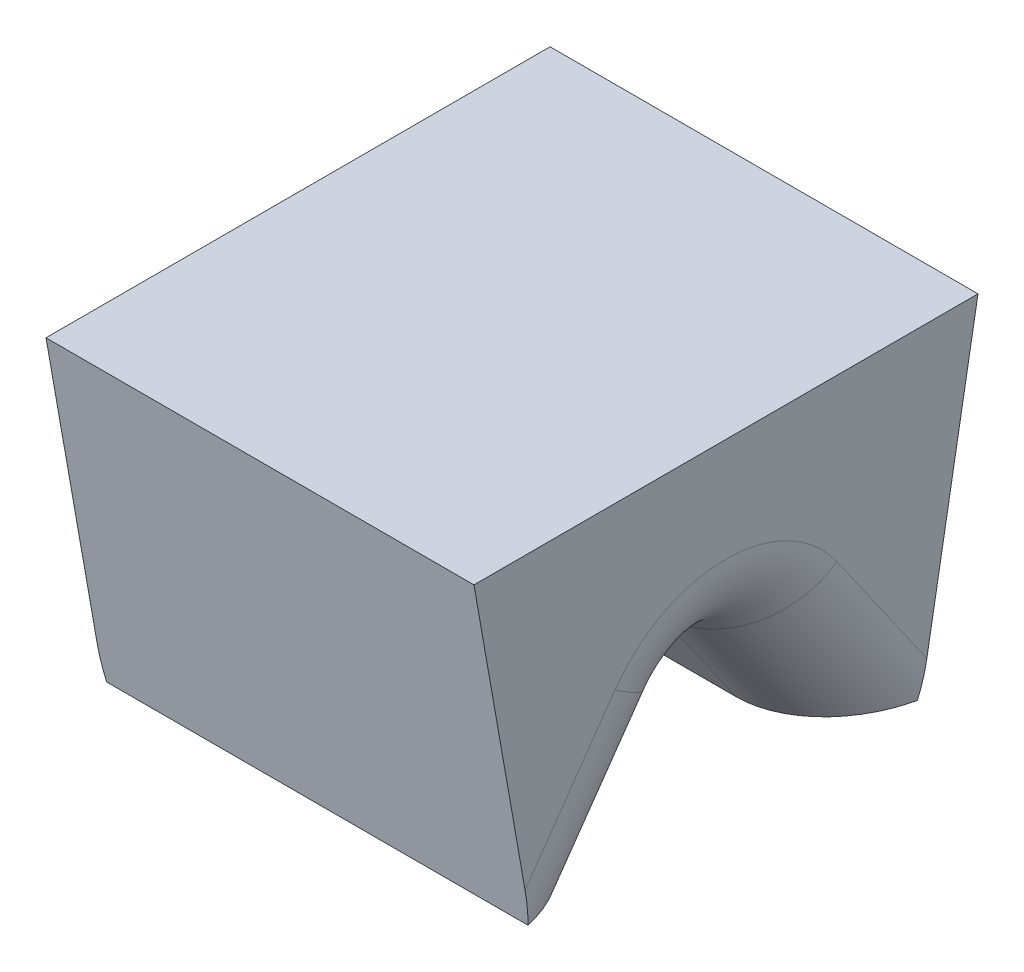
from build123d import *

# Parameters (mm, degrees)
SKETCH_TL_CUTTING_R    = 1.4986
TL_CUTTING_DEPTH       = 75.9968
SKETCH_TDF_CUTTING_W   = 3.01719996
SKETCH_TDF_CUTTING_H   = 3.01719996
TDF_CUTTING_DEPTH      = 77.026345527
VW_VR_GRINDING_DEPTH   = 1.50859998
VW_VR_GRINDING_2_DEPTH = 1.50859998
ISA_GRINDING_DEPTH     = 1.50859998
SKETCH_PRE_FRX_BRX_W   = 0.92980002
SKETCH_PRE_FRX_BRX_H   = 1.4986
SKETCH_PRE_FRX_BRX_W_2 = 0.97757996
PRE_FRX_BRX_DEPTH      = 1.50859998
FA_BA_GRINDING_DEPTH   = 1.50859998
BR_EDM_R               = 0.24892
FR_EDM_R               = 0.24892
SKETCH_ENGRAVING_W     = 0.033186299
SKETCH_ENGRAVING_H     = 1.128593452
SKETCH_ENGRAVING_H_2   = 1.128593453
ENGRAVING_DEPTH        = 0.005


with BuildPart() as part:
    # sketch_TL_cutting → TL_cutting (new body)
    with BuildSketch(Plane(origin=(0, 0, 0), x_dir=(1, 0, 0), z_dir=(0, 1, 0))):
        with Locations(Location((0, 0, 0), (0, 0, 270))):
            Circle(SKETCH_TL_CUTTING_R)
    extrude(amount=TL_CUTTING_DEPTH)

    # sketch_TDF_cutting → TDF_cutting (cut, through all)
    with BuildSketch(Plane(origin=(0, 0, 0), x_dir=(1, 0, 0), z_dir=(0, 1, 0))):
        with Locations((-2.71001998, 0)):
            Rectangle(SKETCH_TDF_CUTTING_W, SKETCH_TDF_CUTTING_H)
    extrude(amount=TDF_CUTTING_DEPTH, mode=Mode.SUBTRACT)


with BuildPart() as body_2:
    # sketch_VW_VR_grinding → VW_VR_grinding (new, symmetric)
    with BuildSketch(Plane(origin=(0, 0, 0), x_dir=(0, 0, -1), z_dir=(1, 0, 0))):
        with BuildLine():
            Line((-1.49360001, -0.00999998), (-1.49360001, 1.487488914))
            ThreePointArc((-1.49360001, 1.487488914), (-1.493648337, 1.488595792), (-1.493792952, 1.489694246))
            Line((-1.493792952, 1.489694246), (-1.51859996, 1.630381782))
            Line((-1.51859996, 1.630381782), (-1.50859998, -0.00999998))
            Line((-1.50859998, -0.00999998), (-1.49360001, -0.00999998))
        make_face()
    extrude(amount=VW_VR_GRINDING_DEPTH, both=True)


with BuildPart() as body_3:
    # sketch_VW_VR_grinding → VW_VR_grinding 2 (new, symmetric)
    with BuildSketch(Plane(origin=(0, 0, 0), x_dir=(0, 0, -1), z_dir=(1, 0, 0))):
        with BuildLine():
            Line((1.49360001, -0.00999998), (1.49360001, 1.487488914))
            ThreePointArc((1.49360001, 1.487488914), (1.493648337, 1.488595792), (1.493792952, 1.489694246))
            Line((1.493792952, 1.489694246), (1.51859996, 1.630381782))
            Line((1.51859996, 1.630381782), (1.50859998, -0.00999998))
            Line((1.50859998, -0.00999998), (1.49360001, -0.00999998))
        make_face()
    extrude(amount=VW_VR_GRINDING_2_DEPTH, both=True)


    add(body_2.part)  # ISA_grinding merges body 2
    # sketch_ISA_grinding → ISA_grinding (add, symmetric)
    with BuildSketch(Plane(origin=(0, 0, 0), x_dir=(0, 0, -1), z_dir=(1, 0, 0))):
        Polygon((-0.50038, 0), (0.50038, 0), (1.50859998, 5.717899643), (1.50859998, -0.02999994), (-1.50859998, -0.02999994), (-1.50859998, 5.717899643), align=None)
    extrude(amount=ISA_GRINDING_DEPTH, both=True)

    # sketch_pre_FRX_BRX → pre_FRX_BRX (add, symmetric)
    with BuildSketch(Plane.XY):
        with Locations((1.03369999, 0.73930002)):
            Rectangle(SKETCH_PRE_FRX_BRX_W, SKETCH_PRE_FRX_BRX_H)
        with Locations((-1.02980998, 0.73930002)):
            Rectangle(SKETCH_PRE_FRX_BRX_W_2, SKETCH_PRE_FRX_BRX_H)
    extrude(amount=PRE_FRX_BRX_DEPTH, both=True)

    # sketch_FA_BA_grinding → FA_BA_grinding (add, symmetric)
    with BuildSketch(Plane.XY):
        Polygon((0.5588, -0.00999998), (0.5588, 1.4986), (1.6256, 9.08927642), (1.6256, -0.00999998), align=None)
        Polygon((-0.54102, -0.00999998), (-0.54102, 1.4986), (-1.32842, 7.101242119), (-1.32842, -0.00999998), align=None)
    extrude(amount=FA_BA_GRINDING_DEPTH, both=True)


with BuildPart() as part_1:
    add(part.part)

    # B1_fix: cut body 3
    add(body_3.part, mode=Mode.SUBTRACT)

    # V-Groove_EDM: sweep along a path in sketch_contour_V-Groove
    with BuildLine(Plane.XY) as v_groove_edm_path:
        Line((-1.20142, 0.32004), (1.4986, 0.32004))
    # sketch_section_V-Groove → V-Groove_EDM (sweep, cut)
    with BuildSketch(Plane(origin=(-1.20142, 0, -1.2954), x_dir=(0, 0, -1), z_dir=(1, 0, 0))):
        with BuildLine():
            Line((-1.214254798, 0.277798482), (-1.012736146, -0.00999998))
            Line((-1.012736146, -0.00999998), (-1.578063854, -0.00999998))
            Line((-1.578063854, -0.00999998), (-1.376545202, 0.277798482))
            ThreePointArc((-1.376545202, 0.277798482), (-1.2954, 0.32004), (-1.214254798, 0.277798482))
        make_face()
    sweep(path=v_groove_edm_path.line, mode=Mode.SUBTRACT)

    # BR_EDM
    br_edm_edges = [part_1.edges().sort_by_distance(p)[0] for p in [
        (0.5588, 0.138899241, -0.178403497),
        (0.5588, 0.32004, 0),
        (0.5588, 0.138899241, 0.178403497),
    ]]
    fillet(br_edm_edges, radius=BR_EDM_R)

    # FR_EDM
    fr_edm_edges = [part_1.edges().sort_by_distance(p)[0] for p in [
        (-0.54102, 0.32004, 0),
        (-0.54102, 0.138899241, -0.178403497),
        (-0.54102, 0.138899241, 0.178403497),
    ]]
    fillet(fr_edm_edges, radius=FR_EDM_R)

    # sketch_Engraving → Engraving (cut)
    # profile 1 of 14: a face of its own
    with BuildSketch(Plane.ZY.offset(1.20142)):
        Polygon((0.531688452, 45.269846756), (0.531688452, 44.551415224), (0.030264207, 44.92787231), (0.030264207, 44.765052028), (-0.034552784, 44.633862437), (-0.102740259, 44.56723057), (-0.296154161, 44.503450651), (-0.425528876, 44.503450651), (-0.618942778, 44.56723057), (-0.749354564, 44.69842016), (-0.81235668, 44.891834063), (-0.81235668, 45.083433089), (-0.749354564, 45.276846991), (-0.682722697, 45.345293734), (-0.555940662, 45.408295849), (-0.541940192, 45.382887589), (-0.665351744, 45.320663277), (-0.724724108, 45.262846521), (-0.785133544, 45.080062605), (-0.785133544, 44.895463814), (-0.724724108, 44.712420631), (-0.604164504, 44.592638831), (-0.42112132, 44.531451591), (-0.299524645, 44.531451591), (-0.116740729, 44.592638831), (-0.059701777, 44.652270463), (0.001485463, 44.772052263), (0.001485463, 44.985429798), (0.502909708, 44.60923198), (0.502909708, 45.269846756), align=None)
    # profile 2 of 14: a face of its own
    with BuildSketch(Plane.ZY.offset(1.20142)):
        Polygon((-0.79576353, 43.729743189), (-0.79576353, 43.758521933), (0.483723879, 43.758521933), (0.316755309, 43.923157091), (0.254530997, 44.049939126), (0.278902186, 44.064976668), (0.341904302, 43.940528044), (0.531688452, 43.74996609), (0.531688452, 43.729743189), align=None)
    # profile 3 of 14: a face of its own
    with BuildSketch(Plane.ZY.offset(1.20142)):
        Polygon((-0.79576353, 42.579837909), (-0.79576353, 42.608616653), (0.483723879, 42.608616653), (0.316755309, 42.773251811), (0.254530997, 42.900033846), (0.278902186, 42.915071388), (0.341904302, 42.790622765), (0.531688452, 42.60006081), (0.531688452, 42.579837909), align=None)
    # profile 4 of 14: a face of its own
    with BuildSketch(Plane.ZY.offset(1.20142)):
        Polygon((-0.786170615, 41.055549687), (-0.79576353, 41.079920876), (-0.367193584, 41.245333838), (-0.367193584, 41.893763019), (-0.79576353, 42.059175981), (-0.786170615, 42.08354717), (0.531688452, 41.578752441), (0.531688452, 41.559566612), align=None)
        Polygon((-0.340748251, 41.255704557), (0.478538519, 41.569159527), (-0.340748251, 41.883133033), align=None, mode=Mode.SUBTRACT)
    # profile 5 of 14: a face of its own
    with BuildSketch(Plane.ZY.offset(1.20142)):
        with Locations((-0.231596438, 40.285083075)):
            Rectangle(SKETCH_ENGRAVING_W, SKETCH_ENGRAVING_H)
    # profile 6 of 14: a face of its own
    with BuildSketch(Plane.ZY.offset(1.20142)):
        Polygon((0.515095302, 38.490248732), (-0.79576353, 38.988821029), (-0.79576353, 39.018636845), (0.521058466, 39.518246214), (0.531688452, 39.493875025), (-0.756354799, 39.003858571), (0.525466021, 38.514619921), align=None)
    # profile 7 of 14: a face of its own
    with BuildSketch(Plane.ZY.offset(1.20142)):
        Polygon((-0.786170615, 38.108295165), (0.502909708, 37.49227448), (0.502909708, 38.347080961), (0.531688452, 38.347080961), (0.531688452, 37.44508771), (-0.79576353, 38.083664709), align=None)
    # profile 8 of 14: a face of its own
    with BuildSketch(Plane.ZY.offset(1.20142)):
        Polygon((-0.554125786, 36.366740389), (-0.749354564, 36.498189247), (-0.81235668, 36.693158757), (-0.81235668, 36.82279274), (-0.749354564, 37.01776225), (-0.554125786, 37.148174036), (-0.237559601, 37.211176152), (-0.044923503, 37.211176152), (0.271901951, 37.148174036), (0.466871461, 37.01776225), (0.531688452, 36.82279274), (0.531688452, 36.693158757), (0.466871461, 36.498189247), (0.271901951, 36.366740389), (-0.044923503, 36.304775345), (-0.237559601, 36.304775345), align=None)
        Polygon((-0.539347512, 36.395778401), (-0.22874449, 36.332776285), (-0.044923503, 36.332776285), (0.26567952, 36.395778401), (0.446907827, 36.515560201), (0.507057995, 36.696788509), (0.507057995, 36.818385184), (0.446907827, 36.999613492), (0.26567952, 37.120173096), (-0.044923503, 37.182397408), (-0.22874449, 37.182397408), (-0.539347512, 37.120173096), (-0.72057582, 36.999613492), (-0.780985256, 36.818385184), (-0.780985256, 36.696788509), (-0.72057582, 36.515560201), align=None, mode=Mode.SUBTRACT)
    # profile 9 of 14: a face of its own
    with BuildSketch(Plane.ZY.offset(1.20142)):
        with Locations((-0.231596438, 35.419971561)):
            Rectangle(SKETCH_ENGRAVING_W, SKETCH_ENGRAVING_H_2)
    # profile 10 of 14: a face of its own
    with BuildSketch(Plane.ZY.offset(1.20142)):
        Polygon((-0.541940192, 34.502759279), (-0.665351744, 34.440534968), (-0.724724108, 34.382718211), (-0.785133544, 34.199934296), (-0.785133544, 34.015335505), (-0.724724108, 33.832292321), (-0.604164504, 33.712510521), (-0.42112132, 33.651323281), (-0.299524645, 33.651323281), (-0.116740729, 33.712510521), (0.003041071, 33.832292321), (0.064487579, 34.015335505), (0.064487579, 34.199934296), (0.003041071, 34.382718211), (-0.086924913, 34.470350784), (0.531688452, 34.402941113), (0.531688452, 33.762289971), (0.502909708, 33.762289971), (0.502909708, 34.377532852), (-0.007329648, 34.434312537), (0.028449332, 34.396718682), (0.092488519, 34.203304779), (0.092488519, 34.011705753), (0.028449332, 33.818291851), (-0.102740259, 33.687102261), (-0.296154161, 33.623322341), (-0.425528876, 33.623322341), (-0.618942778, 33.687102261), (-0.749354564, 33.818291851), (-0.81235668, 34.011705753), (-0.81235668, 34.203304779), (-0.749354564, 34.396718682), (-0.682722697, 34.465165424), (-0.555940662, 34.52816754), align=None)
    # profile 11 of 14: a face of its own
    with BuildSketch(Plane.ZY.offset(1.20142)):
        Polygon((-0.554125786, 32.535382105), (-0.749354564, 32.666830964), (-0.81235668, 32.861800473), (-0.81235668, 32.991434456), (-0.749354564, 33.186403966), (-0.554125786, 33.316815753), (-0.237559601, 33.379817868), (-0.044923503, 33.379817868), (0.271901951, 33.316815753), (0.466871461, 33.186403966), (0.531688452, 32.991434456), (0.531688452, 32.861800473), (0.466871461, 32.666830964), (0.271901951, 32.535382105), (-0.044923503, 32.473417061), (-0.237559601, 32.473417061), align=None)
        Polygon((-0.539347512, 32.564420117), (-0.22874449, 32.501418002), (-0.044923503, 32.501418002), (0.26567952, 32.564420117), (0.446907827, 32.684201917), (0.507057995, 32.865430225), (0.507057995, 32.987026901), (0.446907827, 33.168255208), (0.26567952, 33.288814812), (-0.044923503, 33.351039124), (-0.22874449, 33.351039124), (-0.539347512, 33.288814812), (-0.72057582, 33.168255208), (-0.780985256, 32.987026901), (-0.780985256, 32.865430225), (-0.72057582, 32.684201917), align=None, mode=Mode.SUBTRACT)
    # profile 12 of 14: a face of its own
    with BuildSketch(Plane.ZY.offset(1.20142)):
        Polygon((-0.554125786, 31.385476826), (-0.749354564, 31.516925684), (-0.81235668, 31.711895194), (-0.81235668, 31.841529177), (-0.749354564, 32.036498686), (-0.554125786, 32.166910473), (-0.237559601, 32.229912589), (-0.044923503, 32.229912589), (0.271901951, 32.166910473), (0.466871461, 32.036498686), (0.531688452, 31.841529177), (0.531688452, 31.711895194), (0.466871461, 31.516925684), (0.271901951, 31.385476826), (-0.044923503, 31.323511782), (-0.237559601, 31.323511782), align=None)
        Polygon((-0.539347512, 31.414514838), (-0.22874449, 31.351512722), (-0.044923503, 31.351512722), (0.26567952, 31.414514838), (0.446907827, 31.534296638), (0.507057995, 31.715524945), (0.507057995, 31.837121621), (0.446907827, 32.018349929), (0.26567952, 32.138909533), (-0.044923503, 32.201133844), (-0.22874449, 32.201133844), (-0.539347512, 32.138909533), (-0.72057582, 32.018349929), (-0.780985256, 31.837121621), (-0.780985256, 31.715524945), (-0.72057582, 31.534296638), align=None, mode=Mode.SUBTRACT)
    # profile 13 of 14: a face of its own
    with BuildSketch(Plane.ZY.offset(1.20142)):
        with Locations((-0.231596438, 30.438707997)):
            Rectangle(SKETCH_ENGRAVING_W, SKETCH_ENGRAVING_H_2)
    # profile 14 of 14: a face of its own
    with BuildSketch(Plane.ZY.offset(1.20142)):
        Polygon((-0.79576353, 29.018256595), (-0.79576353, 29.04703534), (0.483723879, 29.04703534), (0.316755309, 29.211670497), (0.254530997, 29.338452532), (0.278902186, 29.353490074), (0.341904302, 29.229041451), (0.531688452, 29.038479497), (0.531688452, 29.018256595), align=None)
    extrude(amount=-ENGRAVING_DEPTH, mode=Mode.SUBTRACT)

    # SurfaceCut1
    split(bisect_by=Plane(origin=(0, 0.835526316, 0), x_dir=(1, 0, 0), z_dir=(0, 1, 0)), keep=Keep.BOTTOM)


solid = part_1.part
